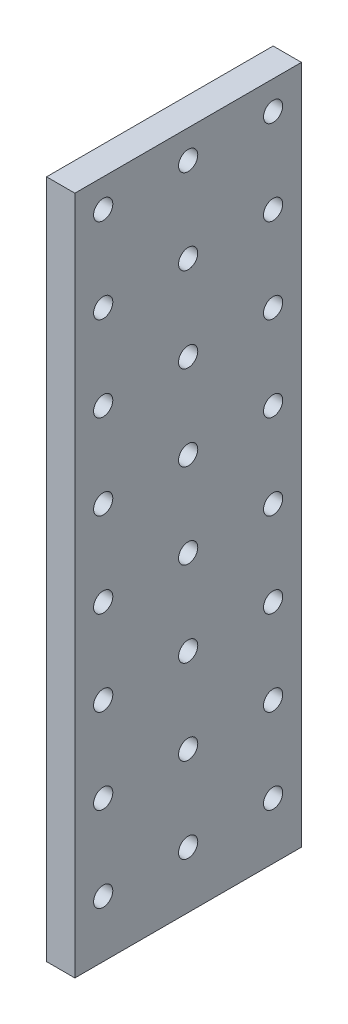
from build123d import *

# Parameters (mm, degrees)
SKETCH1_W           = 50.8
SKETCH1_H           = 152.4
BOSS_EXTRUDE1_DEPTH = 6.35
SKETCH2_R           = 2.15265
CUT_EXTRUDE1_DEPTH  = 81.572467382


with BuildPart() as part:
    # Sketch1 → Boss-Extrude1 (new body)
    with BuildSketch(Plane(origin=(0, 0, 0), x_dir=(0, 0, -1), z_dir=(1, 0, 0))):
        Rectangle(SKETCH1_W, SKETCH1_H)
    extrude(amount=-BOSS_EXTRUDE1_DEPTH)

    # Sketch2 → Cut-Extrude1 (cut, through all)
    with BuildSketch(Plane(origin=(0, 0, 0), x_dir=(0, 0, -1), z_dir=(1, 0, 0))):
        with Locations((-19.05, 69.85)):
            Circle(SKETCH2_R)
        with Locations((0, 69.85)):
            Circle(SKETCH2_R)
        with Locations((19.05, 69.85)):
            Circle(SKETCH2_R)
        with Locations((0, 50.8)):
            Circle(SKETCH2_R)
        with Locations((19.05, 50.8)):
            Circle(SKETCH2_R)
        with Locations((0, 31.75)):
            Circle(SKETCH2_R)
        with Locations((19.05, 31.75)):
            Circle(SKETCH2_R)
        with Locations((0, 12.7)):
            Circle(SKETCH2_R)
        with Locations((19.05, 12.7)):
            Circle(SKETCH2_R)
        with Locations((0, -6.35)):
            Circle(SKETCH2_R)
        with Locations((19.05, -6.35)):
            Circle(SKETCH2_R)
        with Locations((0, -25.4)):
            Circle(SKETCH2_R)
        with Locations((19.05, -25.4)):
            Circle(SKETCH2_R)
        with Locations((0, -44.45)):
            Circle(SKETCH2_R)
        with Locations((19.05, -44.45)):
            Circle(SKETCH2_R)
        with Locations((0, -63.5)):
            Circle(SKETCH2_R)
        with Locations((19.05, -63.5)):
            Circle(SKETCH2_R)
        with Locations((-19.05, 50.8)):
            Circle(SKETCH2_R)
        with Locations((-19.05, 31.75)):
            Circle(SKETCH2_R)
        with Locations((-19.05, 12.7)):
            Circle(SKETCH2_R)
        with Locations((-19.05, -6.35)):
            Circle(SKETCH2_R)
        with Locations((-19.05, -25.4)):
            Circle(SKETCH2_R)
        with Locations((-19.05, -44.45)):
            Circle(SKETCH2_R)
        with Locations((-19.05, -63.5)):
            Circle(SKETCH2_R)
    extrude(amount=-CUT_EXTRUDE1_DEPTH, mode=Mode.SUBTRACT)


solid = part.part
